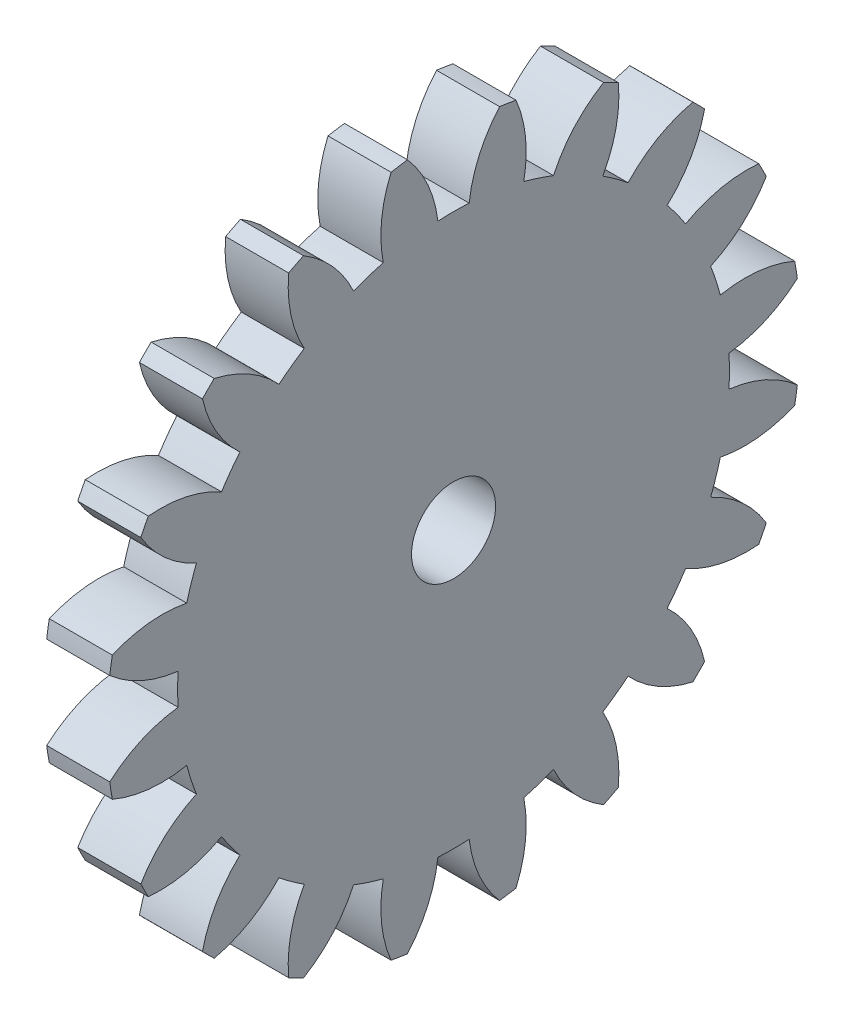
from build123d import *

# Parameters (mm, degrees)
BASPROSKE_W     = 3
BASPROSKE_H     = 16.5
TOOTHCUT_DEPTH  = 24.526580712
TEETHCUTS_COUNT = 20
TEETHCUTS_ANGLE = 342
BORSKE_R        = 2
BORE_DEPTH      = 50.0001016


with BuildPart() as part:
    # BasProSke → Base-Revolve (revolve)
    with BuildSketch(Plane(origin=(0, 0, 0), x_dir=(1, 0, 0), z_dir=(0, 1, 0)), mode=Mode.PRIVATE) as base_revolve_sk:
        with Locations((1.5, 8.25)):
            Rectangle(BASPROSKE_W, BASPROSKE_H)
    revolve(base_revolve_sk.sketch.rotate(Axis((-10, 0, 0), (1, 0, 0)), 180), axis=Axis((-10, 0, 0), (1, 0, 0)))

    # TooCutSke → ToothCut (cut, through all)
    with BuildSketch(Plane(origin=(0, 0, 0), x_dir=(0, 0, -1), z_dir=(1, 0, 0))):
        with BuildLine():
            ThreePointArc((0.74381438, 13.102904875), (0, 13.124), (-0.74381438, 13.102904875))
            ThreePointArc((-0.74381438, 13.102904875), (-1.226473103, 14.852072512), (-2.209965745, 16.376962373))
            ThreePointArc((-2.209965745, 16.376962373), (0, 16.5254), (2.209965745, 16.376962373))
            ThreePointArc((2.209965745, 16.376962373), (1.226473103, 14.852072512), (0.74381438, 13.102904875))
        make_face()
    toothcut = extrude(amount=TOOTHCUT_DEPTH, mode=Mode.SUBTRACT)

    # TeethCuts: ToothCut ×20 about axis
    teethcuts_axis = Axis((-10, 0, 0), (1, 0, 0))
    for i in range(1, TEETHCUTS_COUNT):
        add(toothcut.rotate(teethcuts_axis, i * TEETHCUTS_ANGLE / (TEETHCUTS_COUNT - 1)), mode=Mode.SUBTRACT)

    # BorSke → Bore (cut, symmetric)
    with BuildSketch(Plane(origin=(0, 0, 0), x_dir=(0, 0, -1), z_dir=(1, 0, 0))):
        with Locations(Location((0, 0, 0), (0, 0, 180))):
            Circle(BORSKE_R)
    extrude(amount=BORE_DEPTH, both=True, mode=Mode.SUBTRACT)


solid = part.part
